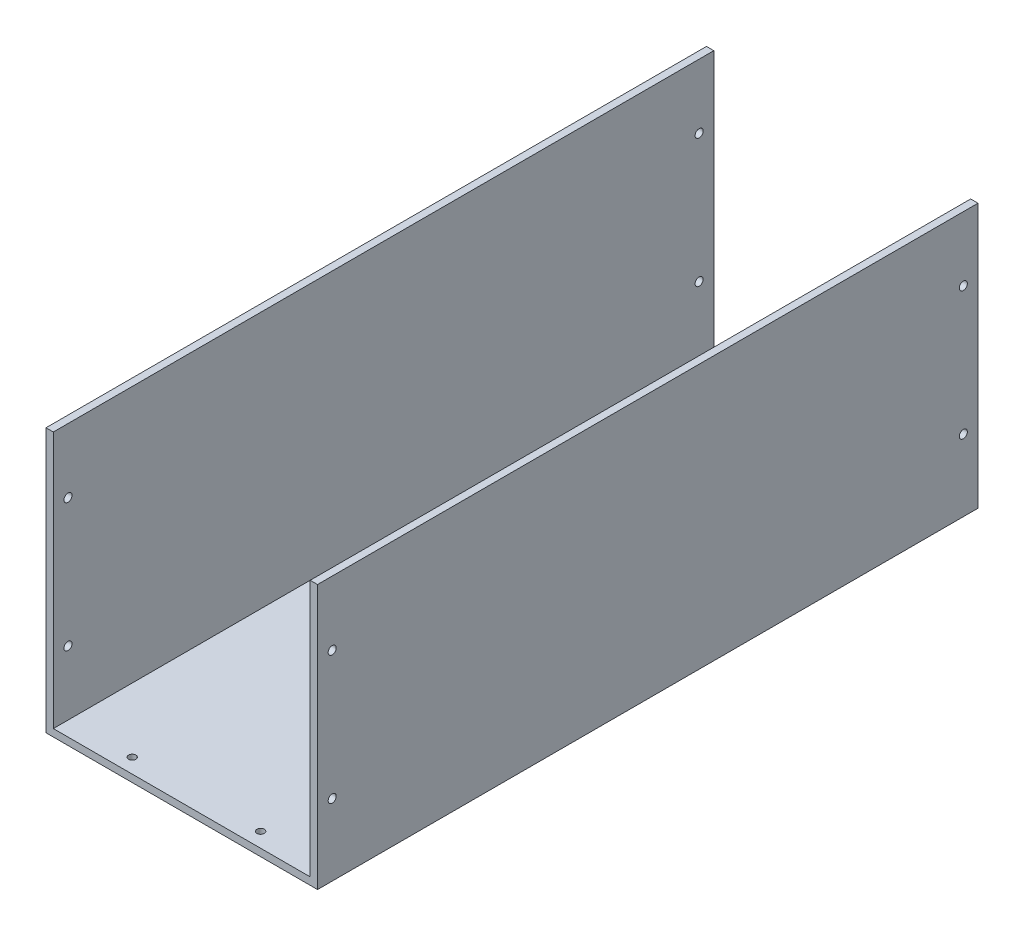
from build123d import *

# Parameters (mm, degrees)
EXTRUDE_3_DEPTH     = 180
SKETCH_3_R          = 1.1
CUT_EXTRUDE_1_DEPTH = 207.823596333
SKETCH_4_R          = 1
CUT_EXTRUDE_2_DEPTH = 197.644349016


with BuildPart() as part:
    # 草图2 → 凸台-拉伸3 (new body)
    with BuildSketch(Plane.XY):
        Polygon((-35, 0), (35, 0), (35, 70), (37, 70), (37, -2), (-37, -2), (-37, 70), (-35, 70), align=None)
    extrude(amount=EXTRUDE_3_DEPTH)

    # 草图3 → 切除-拉伸1 (cut, through all)
    with BuildSketch(Plane(origin=(37, 0, 0), x_dir=(0, 0, -1), z_dir=(1, 0, 0))):
        with Locations((-4, 52.5)):
            Circle(SKETCH_3_R)
        with Locations((-4, 17.5)):
            Circle(SKETCH_3_R)
    cut_extrude_1 = extrude(amount=-CUT_EXTRUDE_1_DEPTH, mode=Mode.SUBTRACT)

    # 镜向1: 切除-拉伸1 across plane
    add(cut_extrude_1.mirror(Plane(origin=(0, 0, 90), x_dir=(1, 0, 0), z_dir=(0, 0, -1))), mode=Mode.SUBTRACT)

    # 草图4 → 切除-拉伸2 (cut, through all)
    with BuildSketch(Plane(origin=(0, 0, 0), x_dir=(1, 0, 0), z_dir=(0, 1, 0))):
        with Locations(Location((-17.5, -4, 0), (0, 0, 180))):
            Circle(SKETCH_4_R)
        with Locations((17.5, -4)):
            Circle(SKETCH_4_R)
        with Locations((-17.5, -176)):
            Circle(SKETCH_4_R)
        with Locations(Location((17.5, -176, 0), (0, 0, 180))):
            Circle(SKETCH_4_R)
    extrude(amount=-CUT_EXTRUDE_2_DEPTH, mode=Mode.SUBTRACT)


solid = part.part
